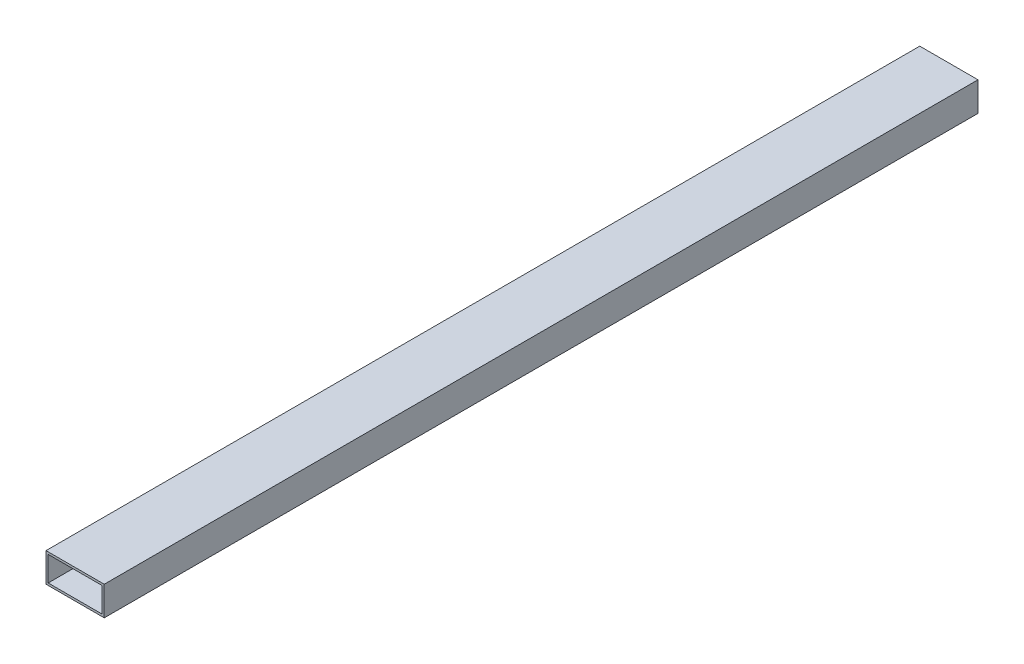
from build123d import *

# Parameters (mm, degrees)
SKETCH_1_W      = 40
SKETCH_1_H      = 20
SKETCH_1_W_2    = 37
SKETCH_1_H_2    = 17
EXTRUDE_1_DEPTH = 600


with BuildPart() as part:
    # Эскиз1 → Бобышка-Вытянуть1 (new body)
    with BuildSketch(Plane.XY):
        with Locations((0, 10)):
            Rectangle(SKETCH_1_W, SKETCH_1_H)
        with Locations((0, 10)):
            Rectangle(SKETCH_1_W_2, SKETCH_1_H_2, mode=Mode.SUBTRACT)
    extrude(amount=EXTRUDE_1_DEPTH)


solid = part.part
